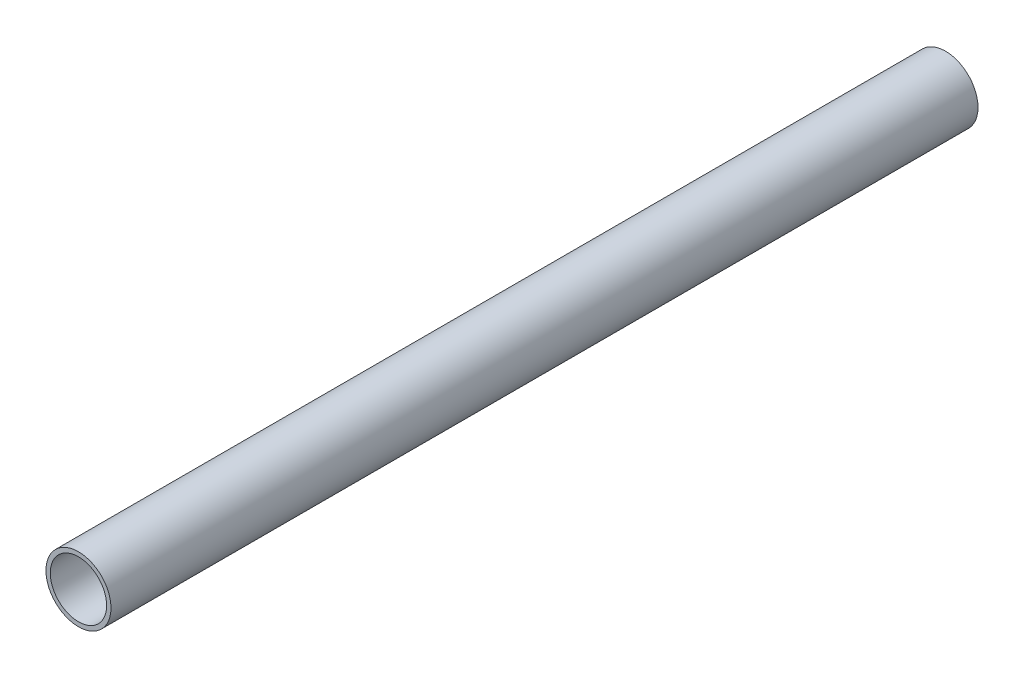
from build123d import *

# Parameters (mm, degrees)
BOSS_EXTRUDE1_DEPTH      = 200
BOSS_EXTRUDE1_DEPTH_BACK = 200
SKETCH1_R                = 15
SKETCH1_R_2              = 13


with BuildPart() as part:
    # Sketch1 → Boss-Extrude1 (new, two sides: drawn at the far end of the back side and taken through both)
    with BuildSketch(Plane.XY.offset(-BOSS_EXTRUDE1_DEPTH_BACK)):
        Circle(SKETCH1_R)
        Circle(SKETCH1_R_2, mode=Mode.SUBTRACT)
    extrude(amount=BOSS_EXTRUDE1_DEPTH + BOSS_EXTRUDE1_DEPTH_BACK)


solid = part.part
